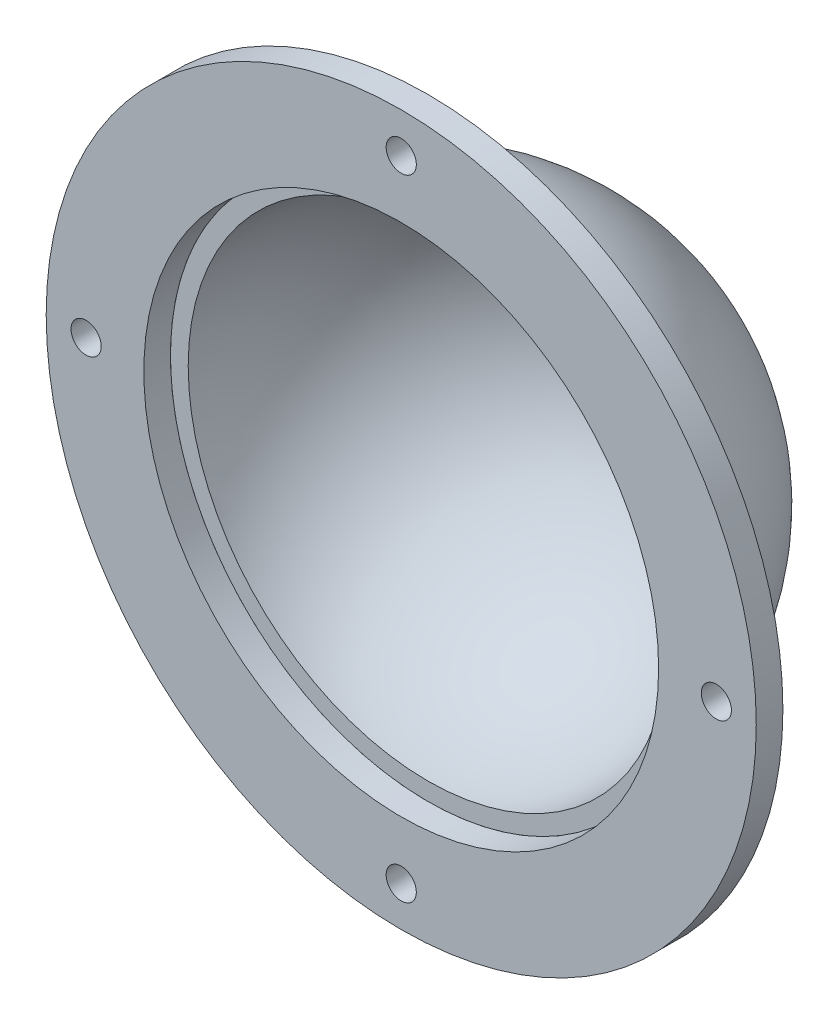
from build123d import *

# Parameters (mm, degrees)
SKETCH_1_R      = 40
SKETCH_1_R_2    = 1.7
SKETCH_1_R_3    = 29
EXTRUDE_1_DEPTH = 3


with BuildPart() as part:
    # 草图1 → 凸台-拉伸1 (new body)
    with BuildSketch(Plane.XY):
        Circle(SKETCH_1_R)
        with Locations((0, 35.5)):
            Circle(SKETCH_1_R_2, mode=Mode.SUBTRACT)
        with Locations((35.5, 0)):
            Circle(SKETCH_1_R_2, mode=Mode.SUBTRACT)
        with Locations((0, -35.5)):
            Circle(SKETCH_1_R_2, mode=Mode.SUBTRACT)
        with Locations((-35.5, 0)):
            Circle(SKETCH_1_R_2, mode=Mode.SUBTRACT)
        Circle(SKETCH_1_R_3, mode=Mode.SUBTRACT)
    extrude(amount=EXTRUDE_1_DEPTH)


with BuildPart() as body_2:
    # 草图2 → 旋转1 (revolve)
    with BuildSketch(Plane(origin=(0, 0, 0), x_dir=(1, 0, 0), z_dir=(0, 1, 0))):
        with BuildLine():
            Line((27, 0), (29, 0))
            ThreePointArc((29, 0), (20.506096654, 20.506096654), (0, 29))
            Line((0, 29), (0, 27))
            ThreePointArc((0, 27), (19.091883092, 19.091883092), (27, 0))
        make_face()
    revolve(axis=Axis((0, 0, -29), (0, 0, 1)))


solid = Compound([part.part, body_2.part])
